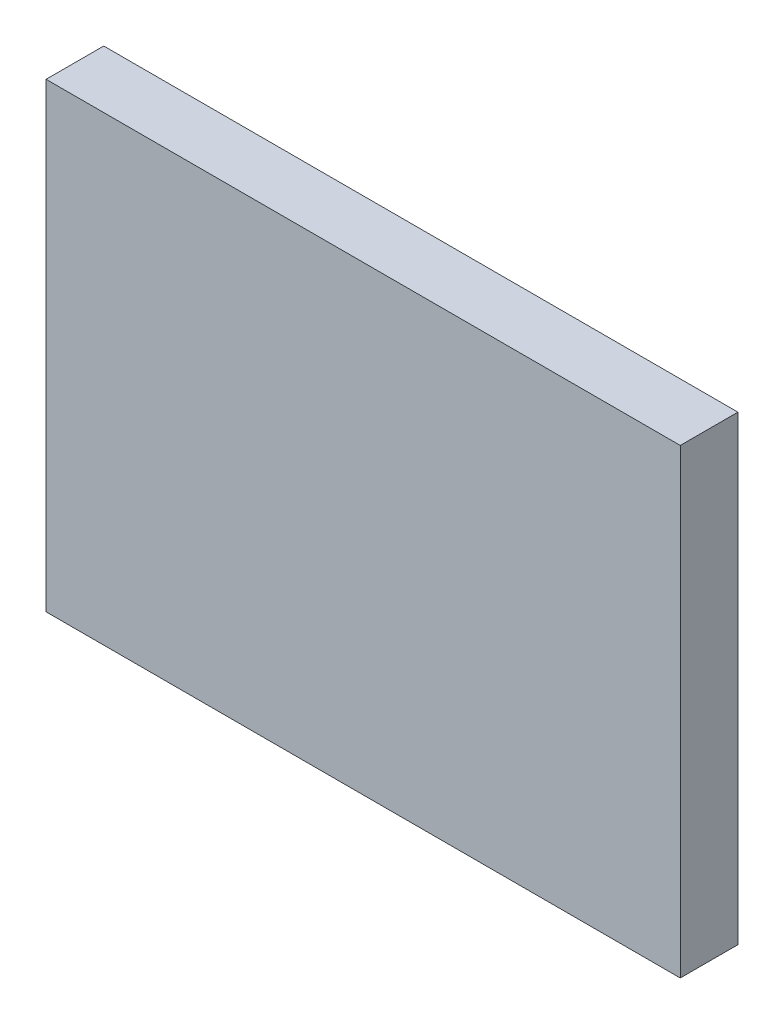
from build123d import *

# Parameters (mm, degrees)
SKETCH1_W           = 69.85
SKETCH1_H           = 50.8
BOSS_EXTRUDE1_DEPTH = 6.35


with BuildPart() as part:
    # Sketch1 → Boss-Extrude1 (new body)
    with BuildSketch(Plane.XY):
        with Locations((34.925, 25.4)):
            Rectangle(SKETCH1_W, SKETCH1_H)
    extrude(amount=BOSS_EXTRUDE1_DEPTH)


solid = part.part
